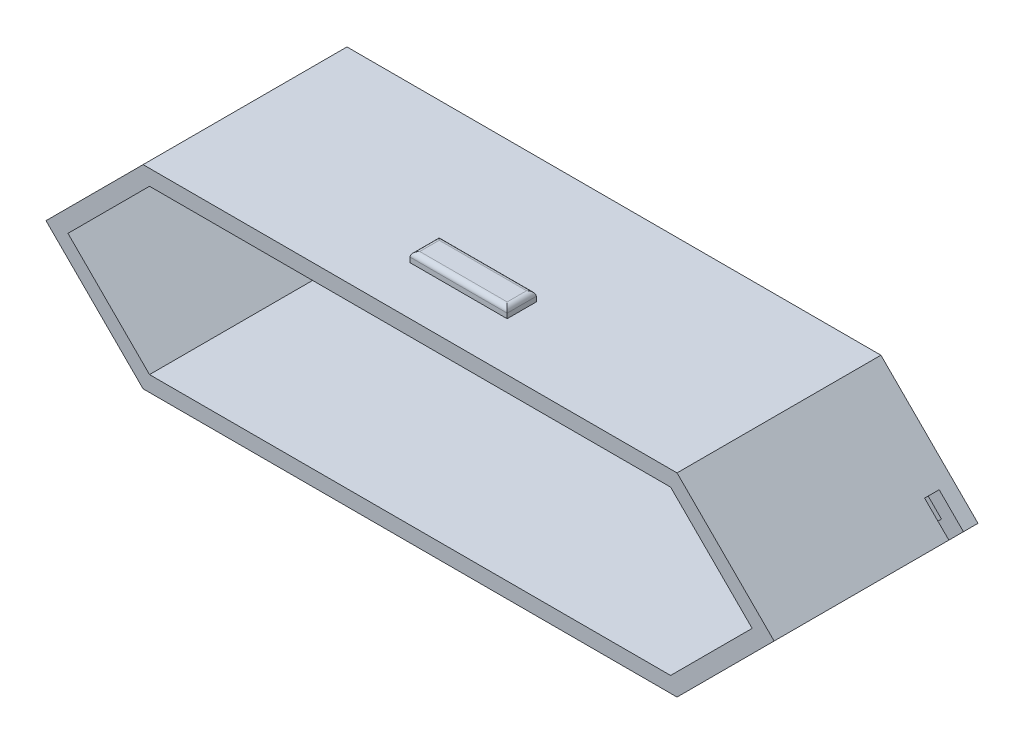
from build123d import *

# Parameters (mm, degrees)
BOSS_EXTRU_1_DEPTH           = 1
BOSS_EXTRU_2_DEPTH           = 20
ENL_V_MAT_EXTRU_1_DEPTH      = 51.671873049
ENL_V_MAT_EXTRU_1_DEPTH_BACK = 51.671873049
ESQUISSE5_W                  = 1.5
ESQUISSE5_H                  = 5
ESQUISSE9_W                  = 10
ESQUISSE9_H                  = 3
BOSS_EXTRU_5_DEPTH           = 1
CONG_1_R                     = 0.5
ESQUISSE10_W                 = 10
ESQUISSE10_H                 = 3
BOSS_EXTRU_6_DEPTH           = 1
CONG_2_R                     = 0.5


with BuildPart() as part:
    # Esquisse1 → Boss.-Extru.1 (new body)
    with BuildSketch(Plane.XY):
        Polygon((34.845351237, 9.251363312), (-20.154648763, 9.251363312), (-30.154648763, -0.748636688), (-20.154648763, -10.748636688), (34.845351237, -10.748636688), (44.845351237, -0.748636688), align=None)
    extrude(amount=BOSS_EXTRU_1_DEPTH)

    # Esquisse2 → Boss.-Extru.2 (add)
    with BuildSketch(Plane.XY.offset(1)):
        Polygon((-20.154648763, -10.748636688), (34.845351237, -10.748636688), (44.845351237, -0.748636688), (34.845351237, 9.251363312), (-20.154648763, 9.251363312), (-30.154648763, -0.748636688), align=None)
        Polygon((-19.491907063, 7.651363312), (-27.891907063, -0.748636688), (-19.491907063, -9.148636688), (34.182609538, -9.148636688), (42.582609538, -0.748636688), (34.182609538, 7.651363312), align=None, mode=Mode.SUBTRACT)
    extrude(amount=BOSS_EXTRU_2_DEPTH)

    # Esquisse5 → Enlèv. mat.-Extru.1 (cut, two sides: drawn at the far end of the back side and taken through both)
    with BuildSketch(Plane(origin=(0, 0, 0), x_dir=(0, 0, -1), z_dir=(1, 0, 0)).offset(-ENL_V_MAT_EXTRU_1_DEPTH_BACK)):
        with Locations((-2.25, -0.748636688)):
            Rectangle(ESQUISSE5_W, ESQUISSE5_H)
    extrude(amount=ENL_V_MAT_EXTRU_1_DEPTH + ENL_V_MAT_EXTRU_1_DEPTH_BACK, mode=Mode.SUBTRACT)

    # Esquisse9 → Boss.-Extru.5 (add)
    with BuildSketch(Plane(origin=(0, 9.251363312, 0), x_dir=(1, 0, 0), z_dir=(0, 1, 0))):
        with Locations((7.345351237, -14.5)):
            Rectangle(ESQUISSE9_W, ESQUISSE9_H)
    extrude(amount=BOSS_EXTRU_5_DEPTH)

    # Congé1
    cong_1_edges = [part.edges().sort_by_distance(p)[0] for p in [
        (2.345351237, 10.251363312, 14.5),
        (7.345351237, 10.251363312, 16),
        (12.345351237, 10.251363312, 14.5),
        (7.345351237, 10.251363312, 13),
    ]]
    fillet(cong_1_edges, radius=CONG_1_R)

    # Esquisse10 → Boss.-Extru.6 (add)
    with BuildSketch(Plane.XZ.offset(10.748636688)):
        with Locations((7.345351237, 14.5)):
            Rectangle(ESQUISSE10_W, ESQUISSE10_H)
    extrude(amount=BOSS_EXTRU_6_DEPTH)

    # Congé2
    cong_2_edges = [part.edges().sort_by_distance(p)[0] for p in [
        (2.345351237, -11.748636688, 14.5),
        (7.345351237, -11.748636688, 13),
        (12.345351237, -11.748636688, 14.5),
        (7.345351237, -11.748636688, 16),
    ]]
    fillet(cong_2_edges, radius=CONG_2_R)


solid = part.part
